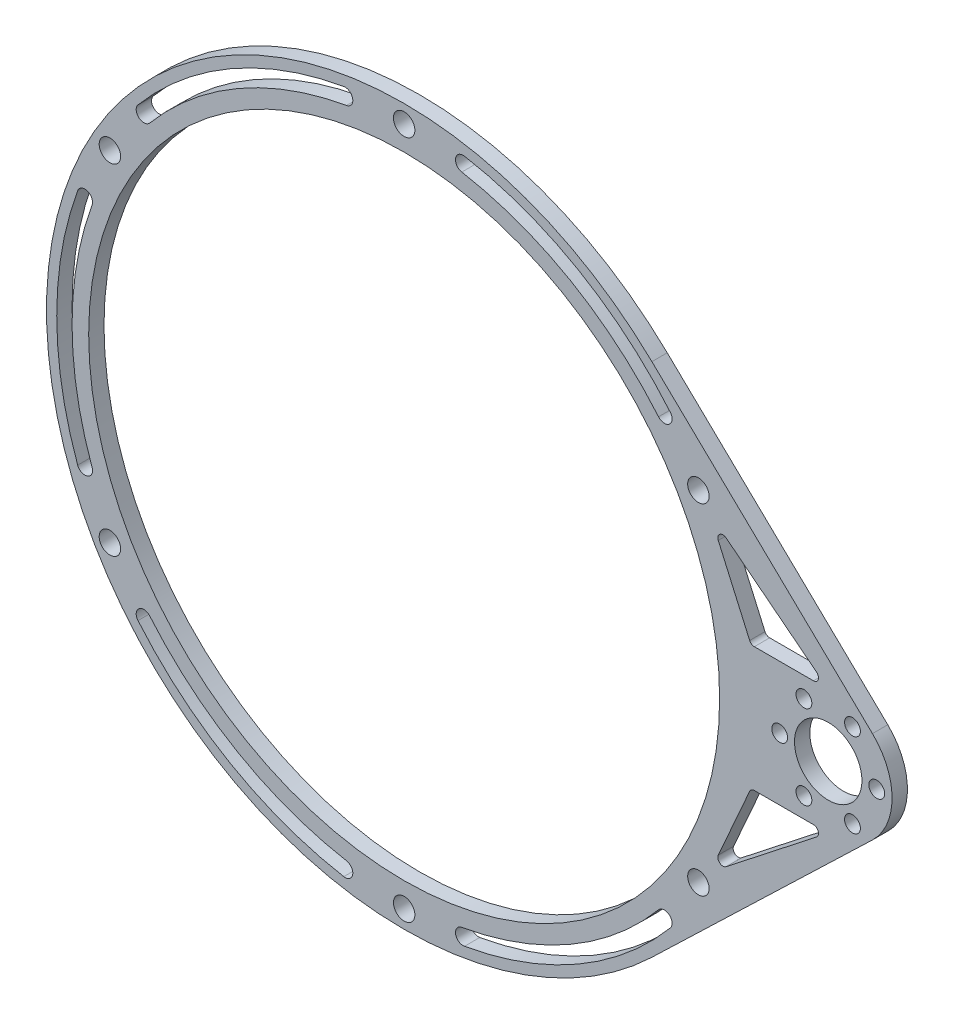
from build123d import *

# Parameters (mm, degrees)
SKETCH_1_R          = 2.1
SKETCH_1_R_2        = 61.75
SKETCH_1_R_3        = 1.55
SKETCH_1_R_4        = 6.6
EXTRUDE_1_DEPTH     = 3
CUT_EXTRUDE_1_DEPTH = 119.445134978
FILLET_1_R          = 1
CUT_EXTRUDE_2_DEPTH = 119.445134978


with BuildPart() as part:
    # 草图1 → 凸台-拉伸1 (new body)
    with BuildSketch(Plane.XY):
        with BuildLine():
            Line((91.659638554, 9.014469486), (48.493975904, 50.48102912))
            ThreePointArc((48.493975904, 50.48102912), (-70, 0), (48.493975904, -50.48102912))
            Line((48.493975904, -50.48102912), (91.659638554, -9.014469486))
            ThreePointArc((91.659638554, -9.014469486), (95.5, 0), (91.659638554, 9.014469486))
        make_face()
        with Locations((0, 66.5)):
            Circle(SKETCH_1_R, mode=Mode.SUBTRACT)
        with Locations((57.590689352, 33.25)):
            Circle(SKETCH_1_R, mode=Mode.SUBTRACT)
        with Locations((0, -66.5)):
            Circle(SKETCH_1_R, mode=Mode.SUBTRACT)
        with Locations((-57.590689352, -33.25)):
            Circle(SKETCH_1_R, mode=Mode.SUBTRACT)
        with Locations((57.590689352, -33.25)):
            Circle(SKETCH_1_R, mode=Mode.SUBTRACT)
        with Locations((-57.590689352, 33.25)):
            Circle(SKETCH_1_R, mode=Mode.SUBTRACT)
        Circle(SKETCH_1_R_2, mode=Mode.SUBTRACT)
        with Locations((87.75, 8.227241336)):
            Circle(SKETCH_1_R_3, mode=Mode.SUBTRACT)
        with Locations((78.25, -8.227241336)):
            Circle(SKETCH_1_R_3, mode=Mode.SUBTRACT)
        with Locations((87.75, -8.227241336)):
            Circle(SKETCH_1_R_3, mode=Mode.SUBTRACT)
        with Locations((73.5, 0)):
            Circle(SKETCH_1_R_3, mode=Mode.SUBTRACT)
        with Locations((83, 0)):
            Circle(SKETCH_1_R_4, mode=Mode.SUBTRACT)
        with Locations((78.25, 8.227241336)):
            Circle(SKETCH_1_R_3, mode=Mode.SUBTRACT)
        with Locations((92.5, 0)):
            Circle(SKETCH_1_R_3, mode=Mode.SUBTRACT)
    extrude(amount=EXTRUDE_1_DEPTH)

    # 草图2 → 切除-拉伸1 (cut, through all)
    with BuildSketch(Plane.XY.offset(3)):
        Polygon((59.859164826, 30.33893107), (67.889886949, 12.18949907), (83, 12.18949907), align=None)
        Polygon((67.889886949, -12.18949907), (83, -12.18949907), (59.859164826, -30.33893107), align=None)
    extrude(amount=-CUT_EXTRUDE_1_DEPTH, mode=Mode.SUBTRACT)

    # 圆角1
    fillet_1_edges = [part.edges().sort_by_distance(p)[0] for p in [
        (59.859164826, 30.33893107, 1.5),
        (83, 12.18949907, 1.5),
        (67.889886949, 12.18949907, 1.5),
        (59.859164826, -30.33893107, 1.5),
        (67.889886949, -12.18949907, 1.5),
        (83, -12.18949907, 1.5),
    ]]
    fillet(fillet_1_edges, radius=FILLET_1_R)

    # 草图3 → 切除-拉伸2 (cut, through all)
    with BuildSketch(Plane.XY.offset(3)):
        with BuildLine():
            ThreePointArc((52.091022132, 43.709557459), (34, 58.889727457), (11.808076081, 66.966927205))
            ThreePointArc((11.808076081, 66.966927205), (10.070392185, 65.750187842), (11.287131548, 64.012503946))
            ThreePointArc((11.287131548, 64.012503946), (32.5, 56.291651246), (49.792888803, 41.78119463))
            ThreePointArc((49.792888803, 41.78119463), (51.906136882, 41.596309379), (52.091022132, 43.709557459))
        make_face()
        with BuildLine():
            ThreePointArc((11.287131548, -64.012503946), (32.5, -56.291651246), (49.792888803, -41.78119463))
            ThreePointArc((49.792888803, -41.78119463), (51.906136882, -41.596309379), (52.091022132, -43.709557459))
            ThreePointArc((52.091022132, -43.709557459), (34, -58.889727457), (11.808076081, -66.966927205))
            ThreePointArc((11.808076081, -66.966927205), (10.070392185, -65.750187842), (11.287131548, -64.012503946))
        make_face()
        with BuildLine():
            ThreePointArc((-49.792888803, -41.78119463), (-32.5, -56.291651246), (-11.287131548, -64.012503946))
            ThreePointArc((-11.287131548, -64.012503946), (-10.070392185, -65.750187842), (-11.808076081, -66.966927205))
            ThreePointArc((-11.808076081, -66.966927205), (-34, -58.889727457), (-52.091022132, -43.709557459))
            ThreePointArc((-52.091022132, -43.709557459), (-51.906136882, -41.596309379), (-49.792888803, -41.78119463))
        make_face()
        with BuildLine():
            ThreePointArc((-61.080020351, 22.231309316), (-65, 0), (-61.080020351, -22.231309316))
            ThreePointArc((-61.080020351, -22.231309316), (-61.976529067, -24.153878462), (-63.899098213, -23.257369746))
            ThreePointArc((-63.899098213, -23.257369746), (-68, 0), (-63.899098213, 23.257369746))
            ThreePointArc((-63.899098213, 23.257369746), (-61.976529067, 24.153878462), (-61.080020351, 22.231309316))
        make_face()
        with BuildLine():
            ThreePointArc((-11.287131548, 64.012503946), (-32.5, 56.291651246), (-49.792888803, 41.78119463))
            ThreePointArc((-49.792888803, 41.78119463), (-51.906136882, 41.596309379), (-52.091022132, 43.709557459))
            ThreePointArc((-52.091022132, 43.709557459), (-34, 58.889727457), (-11.808076081, 66.966927205))
            ThreePointArc((-11.808076081, 66.966927205), (-10.070392185, 65.750187842), (-11.287131548, 64.012503946))
        make_face()
    extrude(amount=-CUT_EXTRUDE_2_DEPTH, mode=Mode.SUBTRACT)


solid = part.part
